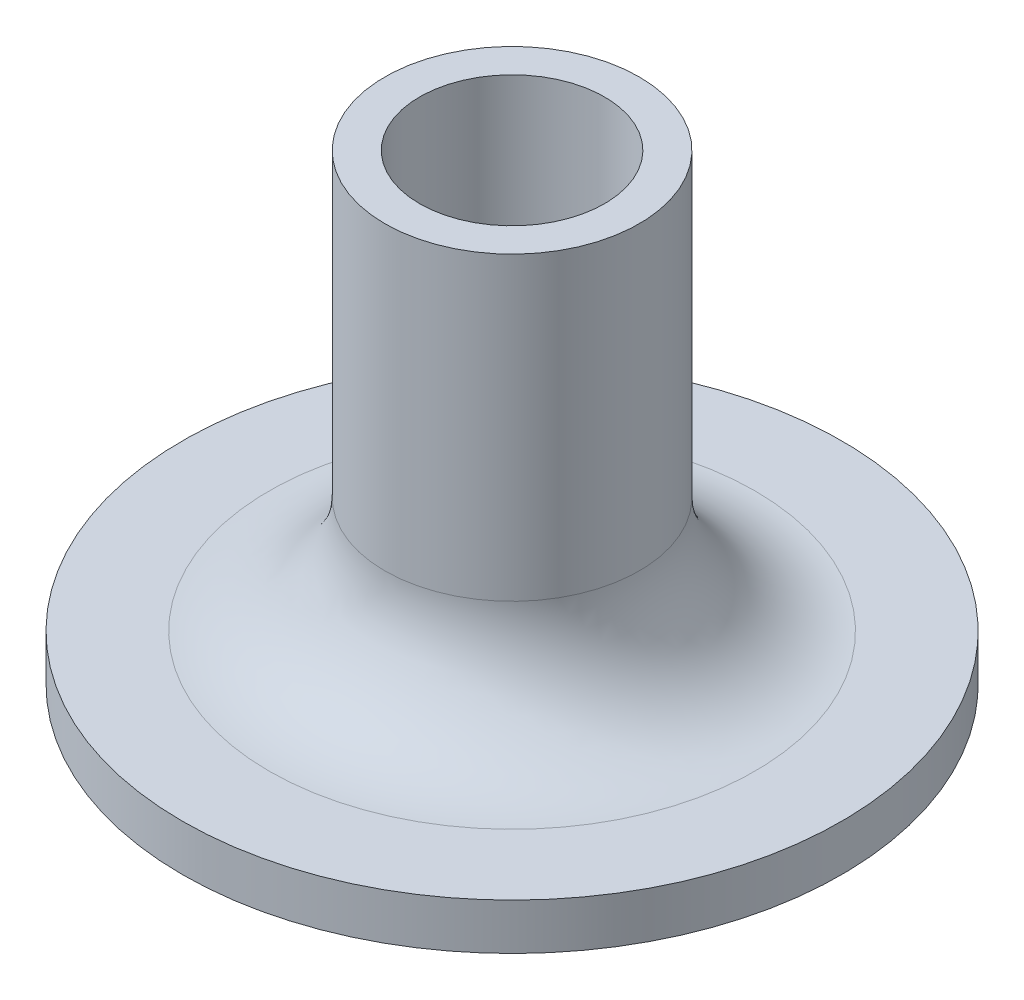
from build123d import *

# Parameters (mm, degrees)
SKETCH1_R           = 14.25
BOSS_EXTRUDE1_DEPTH = 2
SKETCH2_R           = 5.5
SKETCH2_R_2         = 4
BOSS_EXTRUDE2_DEPTH = 18
FILLET1_R           = 5


with BuildPart() as part:
    # Sketch1 → Boss-Extrude1 (new body)
    with BuildSketch(Plane(origin=(0, 0, 0), x_dir=(1, 0, 0), z_dir=(0, 1, 0))):
        with Locations(Location((0, 0, 0), (0, 0, 270))):
            Circle(SKETCH1_R)
    extrude(amount=BOSS_EXTRUDE1_DEPTH)

    # Sketch2 → Boss-Extrude2 (add)
    with BuildSketch(Plane(origin=(0, 2, 0), x_dir=(1, 0, 0), z_dir=(0, 1, 0))):
        with Locations(Location((0, 0, 0), (0, 0, 270))):
            Circle(SKETCH2_R)
        with Locations(Location((0, 0, 0), (0, 0, 270))):
            Circle(SKETCH2_R_2, mode=Mode.SUBTRACT)
    extrude(amount=BOSS_EXTRUDE2_DEPTH)

    # Fillet1
    fillet1_edges = [part.edges().sort_by_distance(p)[0] for p in [
        (0, 2, -5.5),
    ]]
    fillet(fillet1_edges, radius=FILLET1_R)


solid = part.part
